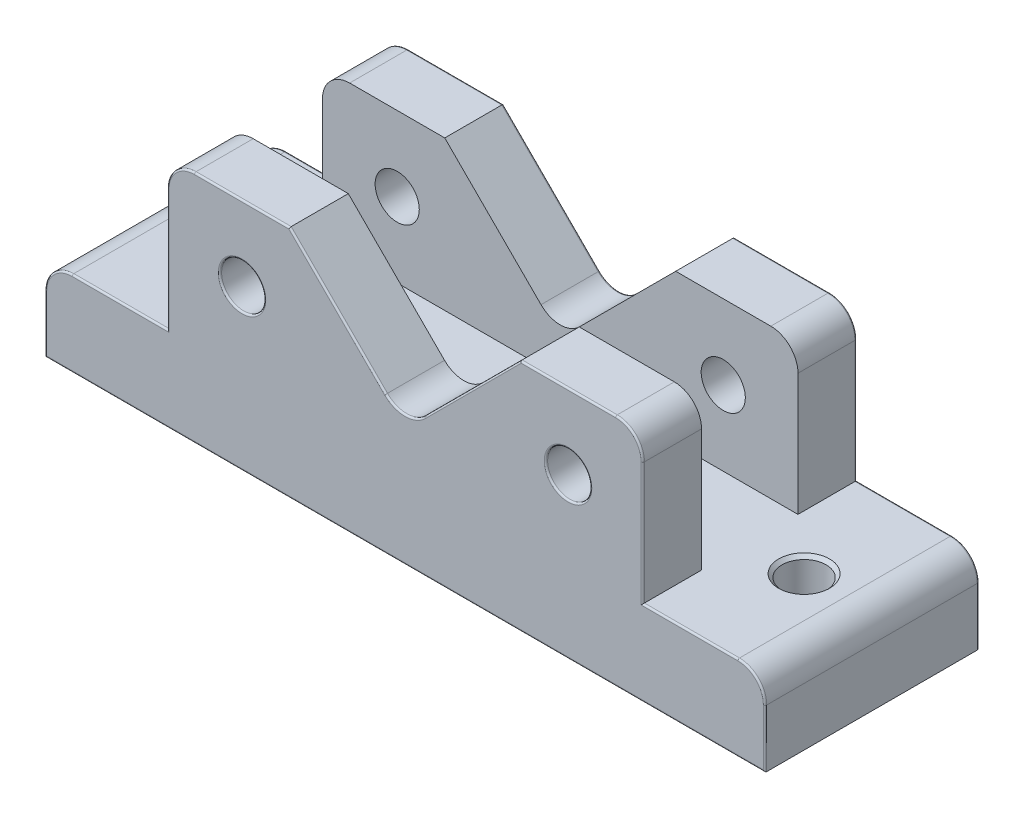
from build123d import *

# Parameters (mm, degrees)
BOSS_EXTRUDE1_DEPTH = 31.5
SKETCH2_W           = 28.4
SKETCH2_H           = 44.105795539
CUT_EXTRUDE2_DEPTH  = 192.64876728
SKETCH4_R           = 6.5
CUT_EXTRUDE3_DEPTH  = 232.676498592
SKETCH5_R           = 6.5
CUT_EXTRUDE4_DEPTH  = 63
FILLET1_R           = 0.5
CHAMFER1_SIZE       = 1


with BuildPart() as part:
    # Sketch1 → Boss-Extrude1 (new, symmetric)
    with BuildSketch(Plane.XY):
        with BuildLine():
            Line((0, 0), (0, 17))
            ThreePointArc((0, 17), (2.343145751, 22.656854249), (8, 25))
            Line((8, 25), (36, 25))
            Line((36, 25), (36, 61))
            ThreePointArc((36, 61), (38.343145751, 66.656854249), (44, 69))
            Line((44, 69), (72, 69))
            Line((72, 69), (100.343145751, 40.656854249))
            ThreePointArc((100.343145751, 40.656854249), (106, 38.313708499), (111.656854249, 40.656854249))
            Line((111.656854249, 40.656854249), (140, 69))
            Line((140, 69), (168, 69))
            ThreePointArc((168, 69), (173.656854249, 66.656854249), (176, 61))
            Line((176, 61), (176, 25))
            Line((176, 25), (204, 25))
            ThreePointArc((204, 25), (209.656854249, 22.656854249), (212, 17))
            Line((212, 17), (212, 0))
            Line((212, 0), (0, 0))
        make_face()
    extrude(amount=BOSS_EXTRUDE1_DEPTH, both=True)

    # Sketch2 → Cut-Extrude2 (cut, through all)
    with BuildSketch(Plane(origin=(176, 0, 0), x_dir=(0, 0, -1), z_dir=(1, 0, 0))):
        with Locations((0, 47.052897769)):
            Rectangle(SKETCH2_W, SKETCH2_H)
    extrude(amount=-CUT_EXTRUDE2_DEPTH, mode=Mode.SUBTRACT)

    # Sketch4 → Cut-Extrude3 (cut, through all)
    with BuildSketch(Plane.XY.offset(31.5)):
        with Locations((58, 47)):
            Circle(SKETCH4_R)
        with Locations(Location((154, 47, 0), (0, 0, 270))):
            Circle(SKETCH4_R)
    extrude(amount=-CUT_EXTRUDE3_DEPTH, mode=Mode.SUBTRACT)

    # Sketch5 → Cut-Extrude4 (cut)
    with BuildSketch(Plane(origin=(0, 25, 0), x_dir=(1, 0, 0), z_dir=(0, 1, 0))):
        with Locations(Location((20, 0, 0), (0, 0, 270))):
            Circle(SKETCH5_R)
        with Locations(Location((192, 0, 0), (0, 0, 270))):
            Circle(SKETCH5_R)
    extrude(amount=-CUT_EXTRUDE4_DEPTH, mode=Mode.SUBTRACT)

    # Fillet1
    fillet1_edges = [part.edges().sort_by_distance(p)[0] for p in [
        (209.656854249, 22.656854249, 31.5),
        (190, 25, 31.5),
        (0, 8.5, -31.5),
        (2.343145751, 22.656854249, -31.5),
        (22, 25, -31.5),
        (36, 43, -31.5),
        (38.343145751, 66.656854249, -31.5),
        (176, 43, 31.5),
        (58, 69, -31.5),
        (86.171572875, 54.828427125, -31.5),
        (106, 38.313708499, -31.5),
        (125.828427125, 54.828427125, -31.5),
        (154, 69, -31.5),
        (173.656854249, 66.656854249, -31.5),
        (176, 43, -31.5),
        (190, 25, -31.5),
        (173.656854249, 66.656854249, 31.5),
        (209.656854249, 22.656854249, -31.5),
        (212, 8.5, -31.5),
        (106, 0, -31.5),
        (154, 69, 31.5),
        (125.828427125, 54.828427125, 31.5),
        (106, 38.313708499, 31.5),
        (86.171572875, 54.828427125, 31.5),
        (58, 69, 31.5),
        (38.343145751, 66.656854249, 31.5),
        (106, 0, 31.5),
        (36, 43, 31.5),
        (22, 25, 31.5),
        (2.343145751, 22.656854249, 31.5),
        (0, 8.5, 31.5),
        (212, 8.5, 31.5),
        (154, 53.5, 31.5),
        (154, 53.5, -31.5),
        (51.5, 47, -31.5),
        (51.5, 47, 31.5),
    ]]
    fillet(fillet1_edges, radius=FILLET1_R)

    # Chamfer1
    chamfer1_edges = [part.edges().sort_by_distance(p)[0] for p in [
        (20, 0, -6.5),
        (20, 25, -6.5),
        (192, 0, -6.5),
        (192, 25, -6.5),
    ]]
    chamfer(chamfer1_edges, length=CHAMFER1_SIZE)


solid = part.part
